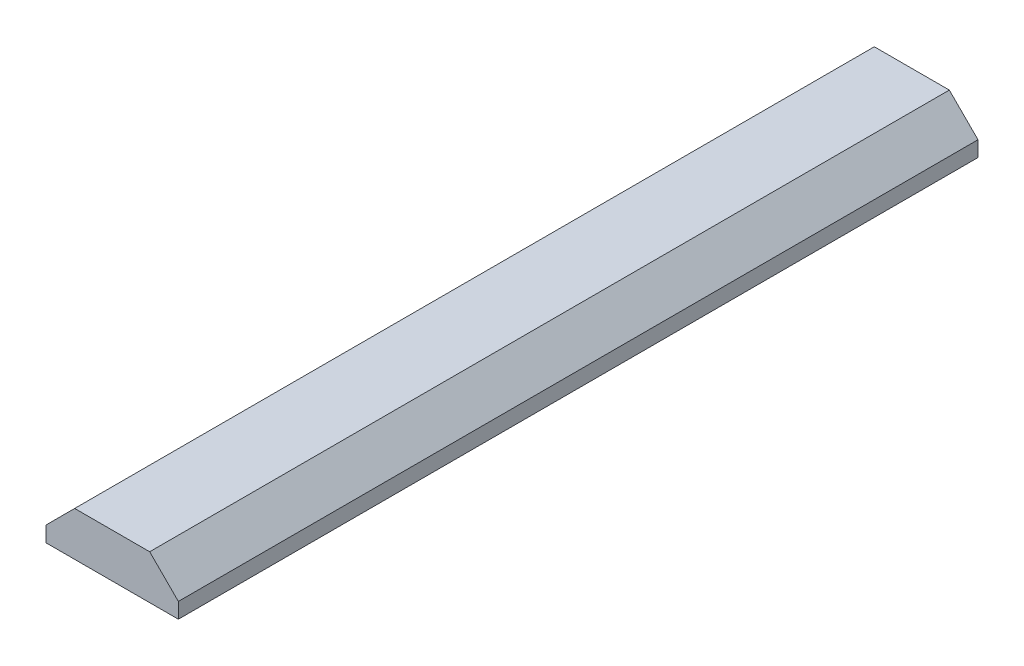
from build123d import *

# Parameters (mm, degrees)
AUFSATZ_LINEAR_AUSTRAGEN1_DEPTH = 72.5


with BuildPart() as part:
    # Skizze1 → Aufsatz-Linear austragen1 (new body)
    with BuildSketch(Plane.XY):
        Polygon((3.4, 1.808858787), (-3.4, 1.808858787), (-6, -0.791141213), (-6, -2.191141213), (6, -2.191141213), (6, -0.791141213), align=None)
    extrude(amount=AUFSATZ_LINEAR_AUSTRAGEN1_DEPTH)


solid = part.part
